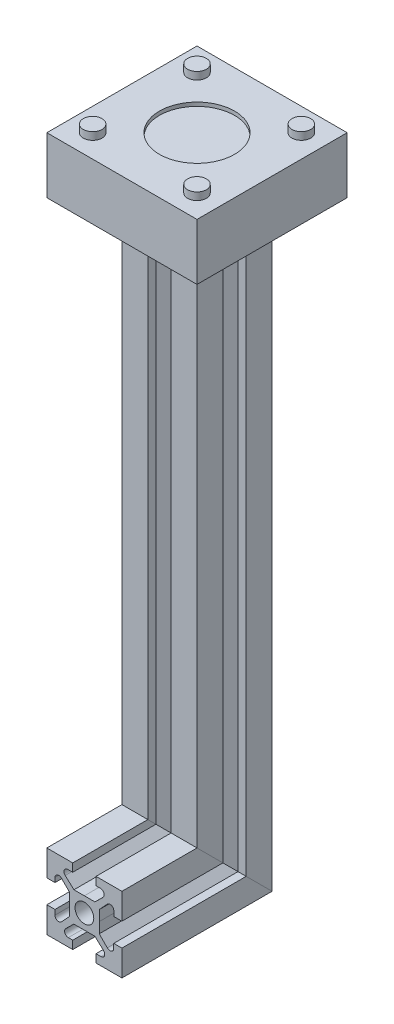
from build123d import *

# Parameters (mm, degrees)
SKETCH2_R           = 2.5
SKETCH4_W           = 40
SKETCH4_H           = 40
BOSS_EXTRUDE1_DEPTH = 15
SKETCH5_R           = 10
CUT_EXTRUDE1_DEPTH  = 1
SKETCH6_R           = 2.5
BOSS_EXTRUDE2_DEPTH = 2


with BuildPart() as part:
    # Sweep1: sweep along a path in Sketch3
    with BuildLine(Plane(origin=(0, 0, 0), x_dir=(0, 0, -1), z_dir=(1, 0, 0))) as sweep1_path:
        Line((0, 0), (30, 0))
        Line((30, 0), (30, 150))
    # Sketch2 → Sweep1 (sweep)
    with BuildSketch(Plane.XY):
        with BuildLine():
            Line((-10, -10), (-3.1, -10))
            Line((-3.1, -10), (-3.1, -7.81857447))
            Line((-3.1, -7.81857447), (-4.285374034, -7.81857447))
            ThreePointArc((-4.285374034, -7.81857447), (-5.210402021, -7.198473435), (-4.988208383, -6.107220917))
            Line((-4.988208383, -6.107220917), (-2.819718275, -3.96470075))
            Line((-2.819718275, -3.96470075), (0, -3.96470075))
            Line((0, -3.96470075), (2.782738033, -3.96470075))
            Line((2.782738033, -3.96470075), (5.105242131, -6.103332486))
            ThreePointArc((5.105242131, -6.103332486), (5.359419929, -7.202533996), (4.427854938, -7.838959152))
            Line((4.427854938, -7.838959152), (3.1, -7.838959152))
            Line((3.1, -7.838959152), (3.1, -10))
            Line((3.1, -10), (10, -10))
            Line((10, -10), (10, -3.1))
            Line((10, -3.1), (7.81857447, -3.1))
            Line((7.81857447, -3.1), (7.81857447, -4.285374034))
            ThreePointArc((7.81857447, -4.285374034), (7.198473435, -5.210402021), (6.107220917, -4.988208383))
            Line((6.107220917, -4.988208383), (3.96470075, -2.819718275))
            Line((3.96470075, -2.819718275), (3.96470075, 0))
            Line((3.96470075, 0), (3.96470075, 2.782738033))
            Line((3.96470075, 2.782738033), (6.103332486, 5.105242131))
            ThreePointArc((6.103332486, 5.105242131), (7.202533996, 5.359419929), (7.838959152, 4.427854938))
            Line((7.838959152, 4.427854938), (7.838959152, 3.1))
            Line((7.838959152, 3.1), (10, 3.1))
            Line((10, 3.1), (10, 10))
            Line((10, 10), (3.1, 10))
            Line((3.1, 10), (3.1, 7.81857447))
            Line((3.1, 7.81857447), (4.285374034, 7.81857447))
            ThreePointArc((4.285374034, 7.81857447), (5.210402021, 7.198473435), (4.988208383, 6.107220917))
            Line((4.988208383, 6.107220917), (2.819718275, 3.96470075))
            Line((2.819718275, 3.96470075), (0, 3.96470075))
            Line((0, 3.96470075), (-2.782738033, 3.96470075))
            Line((-2.782738033, 3.96470075), (-5.105242131, 6.103332486))
            ThreePointArc((-5.105242131, 6.103332486), (-5.359419929, 7.202533996), (-4.427854938, 7.838959152))
            Line((-4.427854938, 7.838959152), (-3.1, 7.838959152))
            Line((-3.1, 7.838959152), (-3.1, 10))
            Line((-3.1, 10), (-10, 10))
            Line((-10, 10), (-10, 3.1))
            Line((-10, 3.1), (-7.81857447, 3.1))
            Line((-7.81857447, 3.1), (-7.81857447, 4.285374034))
            ThreePointArc((-7.81857447, 4.285374034), (-7.198473435, 5.210402021), (-6.107220917, 4.988208383))
            Line((-6.107220917, 4.988208383), (-3.96470075, 2.819718275))
            Line((-3.96470075, 2.819718275), (-3.96470075, 0))
            Line((-3.96470075, 0), (-3.96470075, -2.782738033))
            Line((-3.96470075, -2.782738033), (-6.103332486, -5.105242131))
            ThreePointArc((-6.103332486, -5.105242131), (-7.202533996, -5.359419929), (-7.838959152, -4.427854938))
            Line((-7.838959152, -4.427854938), (-7.838959152, -3.1))
            Line((-7.838959152, -3.1), (-10, -3.1))
            Line((-10, -3.1), (-10, -10))
        make_face()
        Circle(SKETCH2_R, mode=Mode.SUBTRACT)
    sweep(path=sweep1_path.line, transition=Transition.RIGHT)

    # Sketch4 → Boss-Extrude1 (add)
    with BuildSketch(Plane(origin=(0, 150, 0), x_dir=(1, 0, 0), z_dir=(0, 1, 0))):
        with Locations((0, 30)):
            Rectangle(SKETCH4_W, SKETCH4_H)
    extrude(amount=BOSS_EXTRUDE1_DEPTH)

    # Sketch5 → Cut-Extrude1 (cut)
    with BuildSketch(Plane(origin=(0, 165, 0), x_dir=(1, 0, 0), z_dir=(0, 1, 0))):
        with Locations(Location((0, 30, 0), (0, 0, 270))):
            Circle(SKETCH5_R)
    extrude(amount=-CUT_EXTRUDE1_DEPTH, mode=Mode.SUBTRACT)

    # Sketch6 → Boss-Extrude2 (add)
    with BuildSketch(Plane(origin=(0, 165, 0), x_dir=(1, 0, 0), z_dir=(0, 1, 0))):
        with Locations(Location((-13.898862729, 43.898862729, 0), (0, 0, 90))):
            Circle(SKETCH6_R)
        with Locations(Location((13.898862729, 43.898862729, 0), (0, 0, 90))):
            Circle(SKETCH6_R)
        with Locations(Location((13.898862729, 16.101137271, 0), (0, 0, 90))):
            Circle(SKETCH6_R)
        with Locations(Location((-13.898862729, 16.101137271, 0), (0, 0, 90))):
            Circle(SKETCH6_R)
    extrude(amount=BOSS_EXTRUDE2_DEPTH)


solid = part.part
